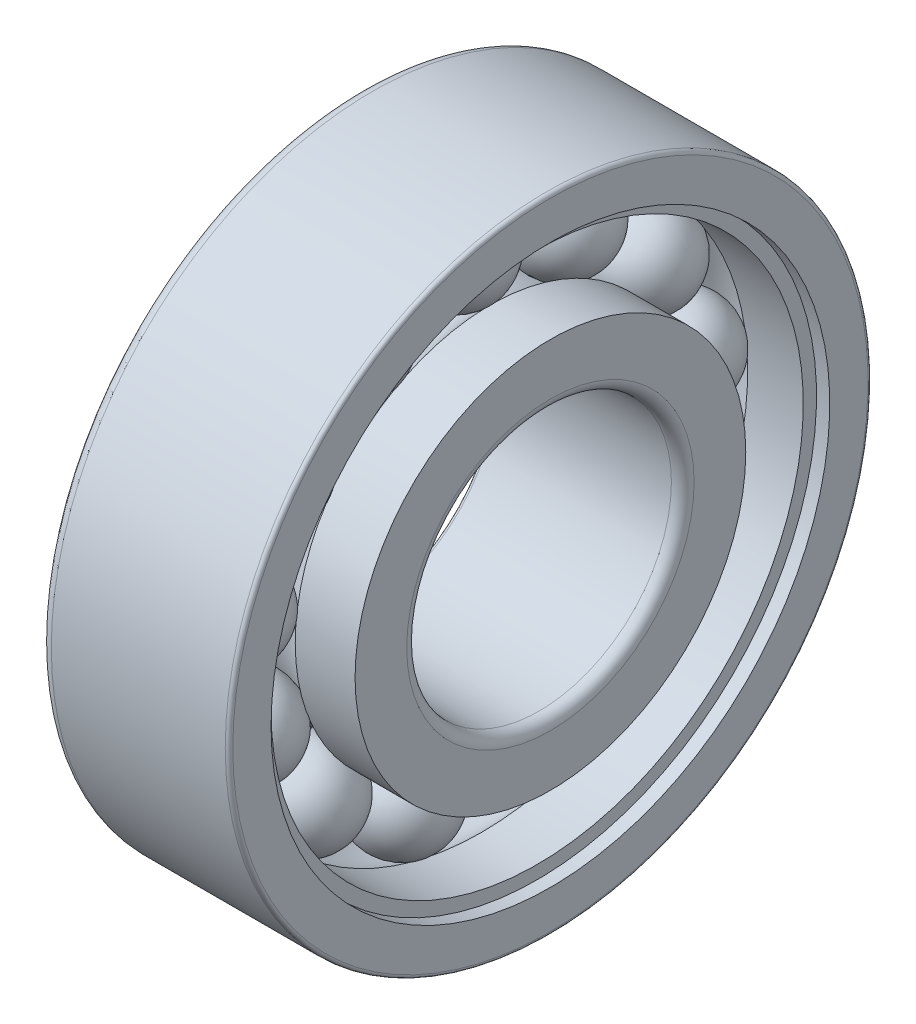
from build123d import *

# Parameters (mm, degrees)
CIRCULAR_PATTERN1_COUNT = 13
FILLET1_R               = 0.3
FILLET2_R               = 0.1


with BuildPart() as part:
    # Sketch1 → Revolve1 (revolve)
    with BuildSketch(Plane.XY):
        with BuildLine():
            Line((-1.25, 6), (1.25, 6))
            ThreePointArc((1.25, 6), (0, 4.75), (-1.25, 6))
        make_face()
    revolve1 = revolve(axis=Axis((-3.091912561, 6, 0), (1, 0, 0)))

    # Sketch2 → Revolve2 (revolve)
    with BuildSketch(Plane.XY, mode=Mode.PRIVATE) as revolve2_sk:
        with BuildLine():
            Line((-2.5, 5.166666667), (-0.918235022, 5.166666667))
            ThreePointArc((-0.918235022, 5.166666667), (0, 4.76), (0.918235022, 5.166666667))
            Line((0.918235022, 5.166666667), (2.5, 5.166666667))
            Line((2.5, 5.166666667), (2.5, 3.5))
            Line((2.5, 3.5), (-2.5, 3.5))
            Line((-2.5, 3.5), (-2.5, 5.166666667))
        make_face()
    revolve(revolve2_sk.sketch.rotate(Axis((-2.992358943, 0, 0), (1, 0, 0)), 90), axis=Axis((-2.992358943, 0, 0), (1, 0, 0)))

    # Sketch3 → Revolve3 (revolve)
    with BuildSketch(Plane.XY, mode=Mode.PRIVATE) as revolve3_sk:
        with BuildLine():
            Line((-2.5, 6.833333333), (-2.5, 8.5))
            Line((-2.5, 8.5), (2.5, 8.5))
            Line((2.5, 8.5), (2.5, 7.388333333))
            Line((2.5, 7.388333333), (2.15, 7.388333333))
            Line((2.15, 7.388333333), (2.15, 7.038333333))
            Line((2.15, 7.038333333), (0.677837657, 7.038333333))
            ThreePointArc((0.677837657, 7.038333333), (-0.157968267, 7.229896754), (-0.918235022, 6.833333333))
            Line((-0.918235022, 6.833333333), (-2.5, 6.833333333))
        make_face()
    revolve(revolve3_sk.sketch.rotate(Axis((-2.992358943, 0, 0), (1, 0, 0)), 90), axis=Axis((-2.992358943, 0, 0), (1, 0, 0)))

    # Circular-Pattern1: Revolve1 ×13 about axis
    circular_pattern1_axis = Axis((0, 0, 0), (1, 0, 0))
    for i in range(1, CIRCULAR_PATTERN1_COUNT):
        add(revolve1.rotate(circular_pattern1_axis, i * 360 / CIRCULAR_PATTERN1_COUNT))

    # Fillet1
    fillet1_edges = [part.edges().sort_by_distance(p)[0] for p in [
        (-2.5, 0, -8.5),
        (2.5, 0, -3.5),
    ]]
    fillet(fillet1_edges, radius=FILLET1_R)

    # Fillet2
    fillet2_edges = [part.edges().sort_by_distance(p)[0] for p in [
        (2.5, 0, -8.5),
        (-2.5, 0, -3.5),
    ]]
    fillet(fillet2_edges, radius=FILLET2_R)


solid = part.part
